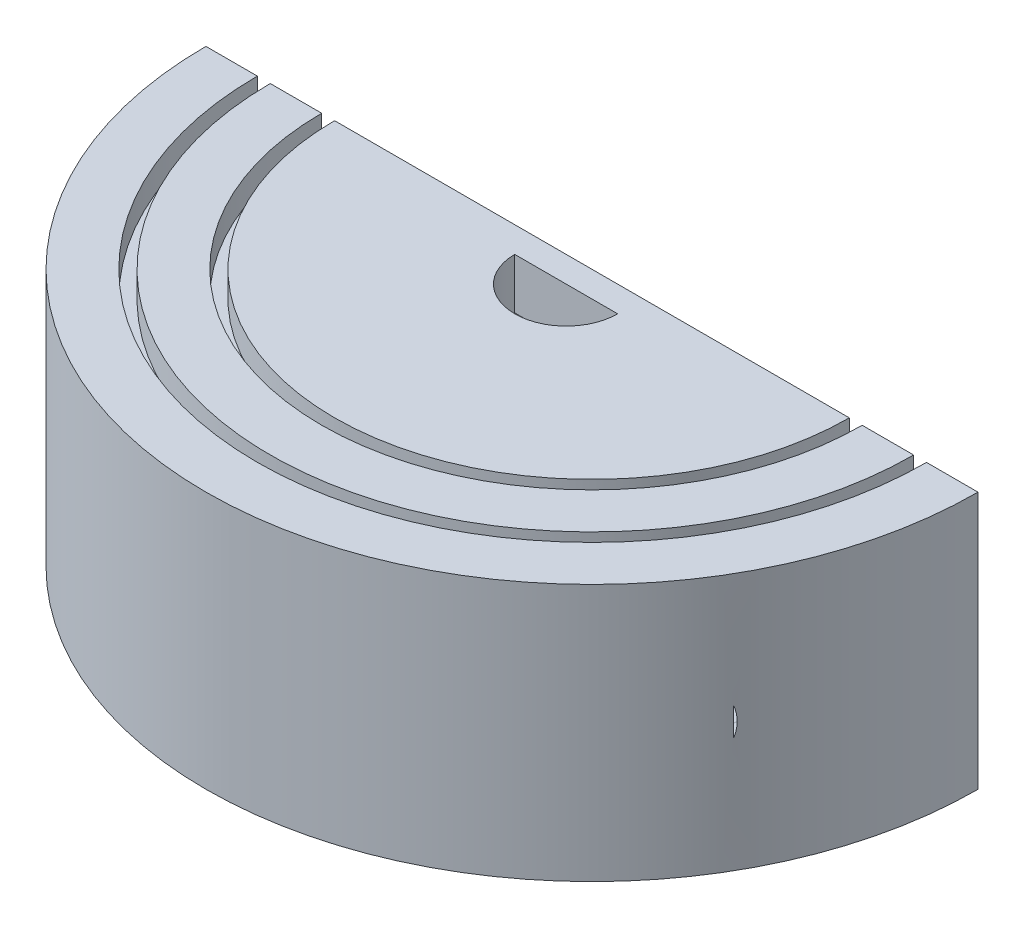
from build123d import *

# Parameters (mm, degrees)
EXTRUDE_1_DEPTH     = 5
CUT_EXTRUDE_2_DEPTH = 1
CUT_EXTRUDE_3_DEPTH = 1
CUT_EXTRUDE_4_DEPTH = 7.5
CUT_EXTRUDE_5_DEPTH = 2


with BuildPart() as part:
    # 草图1 → 凸台-拉伸1 (new, symmetric)
    with BuildSketch(Plane(origin=(0, 0, 0), x_dir=(1, 0, 0), z_dir=(0, 1, 0))):
        with BuildLine():
            Line((0, 0), (30, 0))
            ThreePointArc((30, 0), (15, -15), (0, 0))
        make_face()
    extrude(amount=EXTRUDE_1_DEPTH, both=True)

    # 草图2 → 切除-拉伸2 (cut)
    with BuildSketch(Plane.XZ.offset(5)):
        with BuildLine():
            Line((2, 0), (2.5, 0))
            ThreePointArc((2.5, 0), (15, 12.5), (27.5, 0))
            Line((27.5, 0), (28, 0))
            ThreePointArc((28, 0), (15, 13), (2, 0))
        make_face()
    cut_extrude_2 = extrude(amount=-CUT_EXTRUDE_2_DEPTH, mode=Mode.SUBTRACT)

    # 草图3 → 切除-拉伸3 (cut)
    with BuildSketch(Plane.XZ.offset(5)):
        with BuildLine():
            Line((4.5, 0), (5, 0))
            ThreePointArc((5, 0), (15, 10), (25, 0))
            Line((25, 0), (25.5, 0))
            ThreePointArc((25.5, 0), (15, 10.5), (4.5, 0))
        make_face()
    cut_extrude_3 = extrude(amount=-CUT_EXTRUDE_3_DEPTH, mode=Mode.SUBTRACT)

    # 镜向1: 切除-拉伸2, 切除-拉伸3 across plane
    add(cut_extrude_2.mirror(Plane(origin=(0, 0, 0), x_dir=(0, 0, 1), z_dir=(0, -1, 0))), mode=Mode.SUBTRACT)
    add(cut_extrude_3.mirror(Plane(origin=(0, 0, 0), x_dir=(0, 0, 1), z_dir=(0, -1, 0))), mode=Mode.SUBTRACT)

    # 草图5 → 切除-拉伸4 (cut)
    with BuildSketch(Plane(origin=(0, 0, 0), x_dir=(-1, 0, 0), z_dir=(0, 0, -1))):
        with BuildLine():
            Line((-25.030175513, -3), (-5.030175513, -3))
            ThreePointArc((-5.030175513, -3), (-2.01419916, 0.015976353), (-5.030175513, 3.031952706))
            Line((-5.030175513, 3.031952706), (-25.030175513, 3.031952706))
            ThreePointArc((-25.030175513, 3.031952706), (-28.046151866, 0.015976353), (-25.030175513, -3))
        make_face()
    extrude(amount=-CUT_EXTRUDE_4_DEPTH, mode=Mode.SUBTRACT)

    # 草图6 → 切除-拉伸5 (cut)
    with BuildSketch(Plane.XZ.offset(5)):
        with BuildLine():
            Line((13, 1), (17, 1))
            ThreePointArc((17, 1), (15, 3), (13, 1))
        make_face()
    cut_extrude_5 = extrude(amount=-CUT_EXTRUDE_5_DEPTH, mode=Mode.SUBTRACT)

    # 镜向2: 切除-拉伸5 across plane
    add(cut_extrude_5.mirror(Plane(origin=(0, 0, 0), x_dir=(0, 0, 1), z_dir=(0, -1, 0))), mode=Mode.SUBTRACT)


solid = part.part
